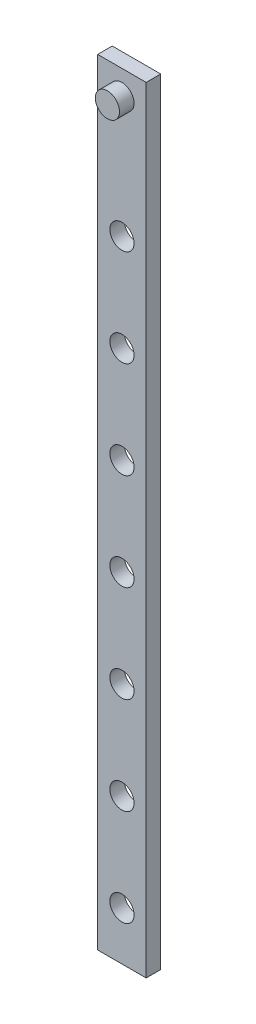
from build123d import *

# Parameters (mm, degrees)
SKETCH_1_W      = 10
SKETCH_1_H      = 160
SKETCH_1_R      = 2.5
EXTRUDE_1_DEPTH = 3
SKETCH_2_R      = 2.5
EXTRUDE_2_DEPTH = 3


with BuildPart() as part:
    # 草圖1 → 填料-伸長1 (new body)
    with BuildSketch(Plane.XY):
        Rectangle(SKETCH_1_W, SKETCH_1_H)
        with Locations((0, -70)):
            Circle(SKETCH_1_R, mode=Mode.SUBTRACT)
        with Locations((0, -50)):
            Circle(SKETCH_1_R, mode=Mode.SUBTRACT)
        with Locations((0, -30)):
            Circle(SKETCH_1_R, mode=Mode.SUBTRACT)
        with Locations((0, -10)):
            Circle(SKETCH_1_R, mode=Mode.SUBTRACT)
        with Locations((0, 10)):
            Circle(SKETCH_1_R, mode=Mode.SUBTRACT)
        with Locations((0, 30)):
            Circle(SKETCH_1_R, mode=Mode.SUBTRACT)
        with Locations((0, 50)):
            Circle(SKETCH_1_R, mode=Mode.SUBTRACT)
    extrude(amount=EXTRUDE_1_DEPTH)

    # 草圖2 → 填料-伸長2 (add)
    with BuildSketch(Plane.XY.offset(3)):
        with Locations(Location((0, 75, 0), (0, 0, 180))):
            Circle(SKETCH_2_R)
    extrude(amount=EXTRUDE_2_DEPTH)


solid = part.part
